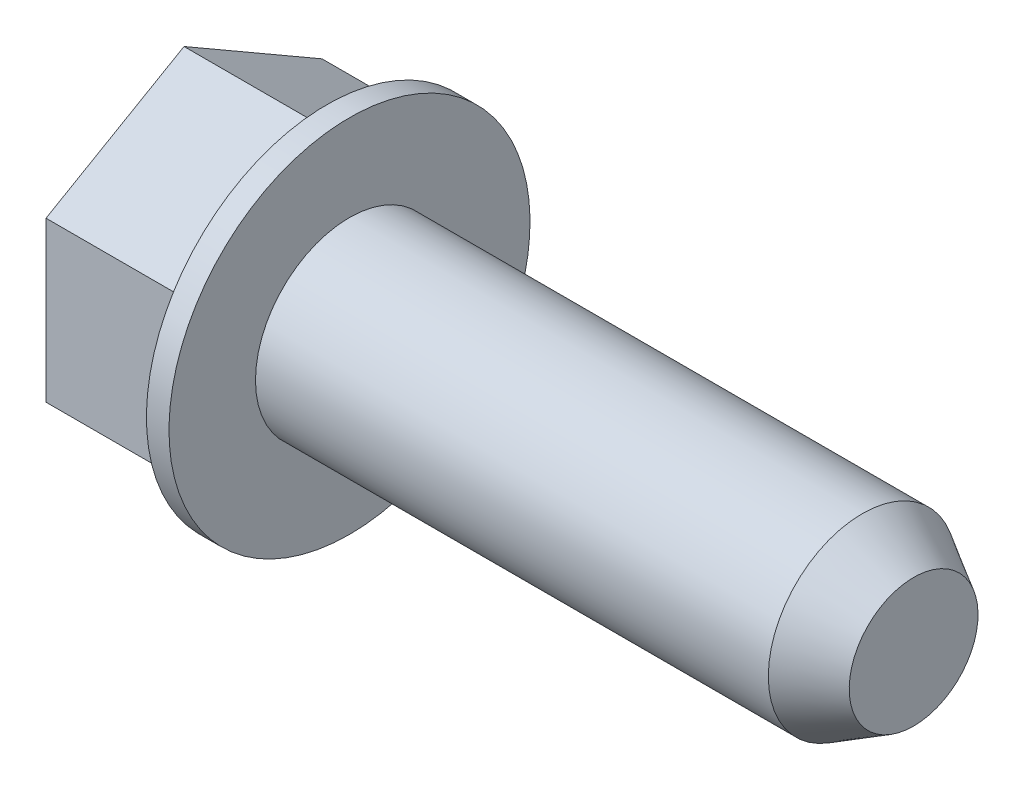
from build123d import *

# Parameters (mm, degrees)
BOSS_EXTRUDE1_DEPTH = 4.826
SKETCH3_R           = 3.72872
CUT_EXTRUDE1_DEPTH  = 0.9652
CHAMFER1_SIZE       = 1
CHAMFER1_SIZE2      = 1.732050808


with BuildPart() as part:
    # Sketch1 → Revolve1 (revolve)
    with BuildSketch(Plane.XY, mode=Mode.PRIVATE) as revolve1_sk:
        Polygon((4.6228, 6.096), (3.8608, 6.096), (3.8608, 4.6609), (-0.9652, 4.6609), (-0.9652, 0), (0, 0), (4.6228, 0), (23.6728, 0), (23.6728, 3.175), (4.6228, 3.175), align=None)
    revolve(revolve1_sk.sketch.rotate(Axis((4.6228, 0, 0), (1, 0, 0)), 180), axis=Axis((4.6228, 0, 0), (1, 0, 0)))

    # Sketch2 → Boss-Extrude1 (add)
    with BuildSketch(Plane.ZY.offset(-3.8608)):
        Polygon((0, 5.381943739), (-4.6609, 2.69097187), (-4.6609, -2.69097187), (0, -5.381943739), (4.6609, -2.69097187), (4.6609, 2.69097187), align=None)
    extrude(amount=BOSS_EXTRUDE1_DEPTH)

    # Sketch3 → Cut-Extrude1 (cut)
    with BuildSketch(Plane.ZY.offset(0.9652)):
        with Locations(Location((0, 0, 0), (0, 0, 270))):
            Circle(SKETCH3_R)
    extrude(amount=-CUT_EXTRUDE1_DEPTH, mode=Mode.SUBTRACT)

    # Chamfer1
    chamfer1_edges = [part.edges().sort_by_distance(p)[0] for p in [
        (23.6728, 3.175, 0),
    ]]
    chamfer1_side = [part.faces().sort_by_distance(p)[0] for p in [
        (23.6728, 0, 0),
    ]]
    chamfer(chamfer1_edges, length=CHAMFER1_SIZE, length2=CHAMFER1_SIZE2, reference=chamfer1_side[0])


solid = part.part
